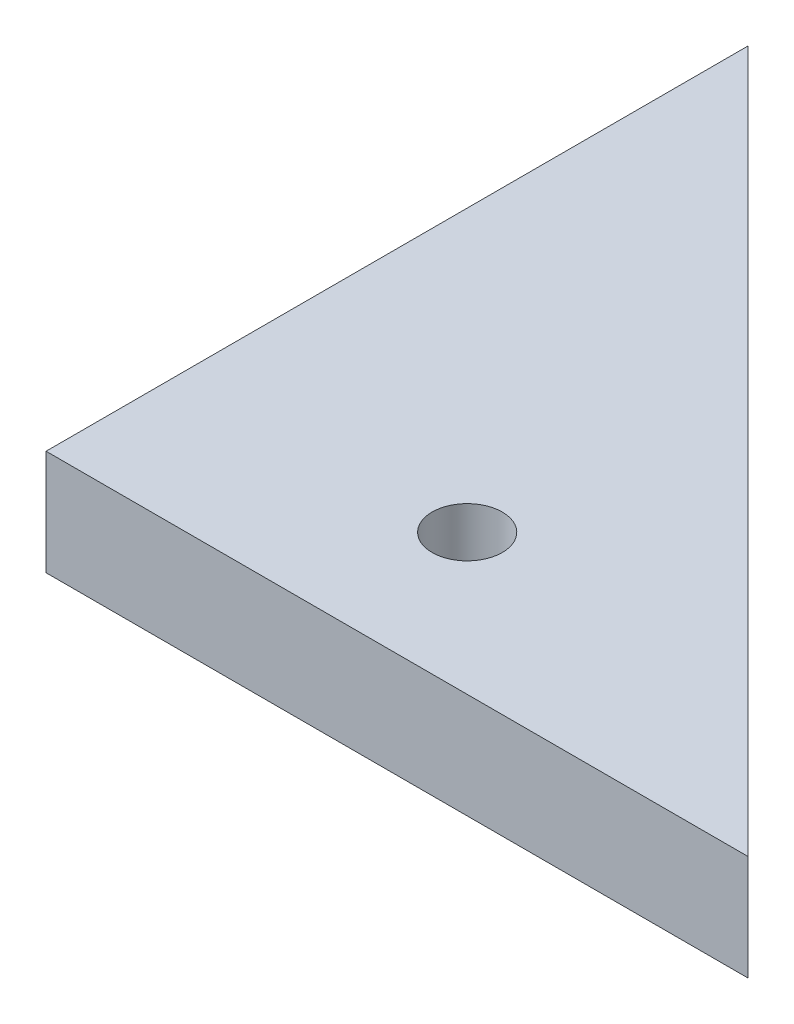
from build123d import *

# Parameters (mm, degrees)
SKETCH1_R           = 6.35
BOSS_EXTRUDE1_DEPTH = 19.05


with BuildPart() as part:
    # Sketch1 → Boss-Extrude1 (new body)
    with BuildSketch(Plane(origin=(0, 0, 0), x_dir=(1, 0, 0), z_dir=(0, 1, 0))):
        Polygon((-14.358347107, 0), (-14.358347107, 127), (112.641652893, 0), align=None)
        with Locations(Location((36.441652893, 25.4, 0), (0, 0, 90))):
            Circle(SKETCH1_R, mode=Mode.SUBTRACT)
    extrude(amount=BOSS_EXTRUDE1_DEPTH)


solid = part.part
